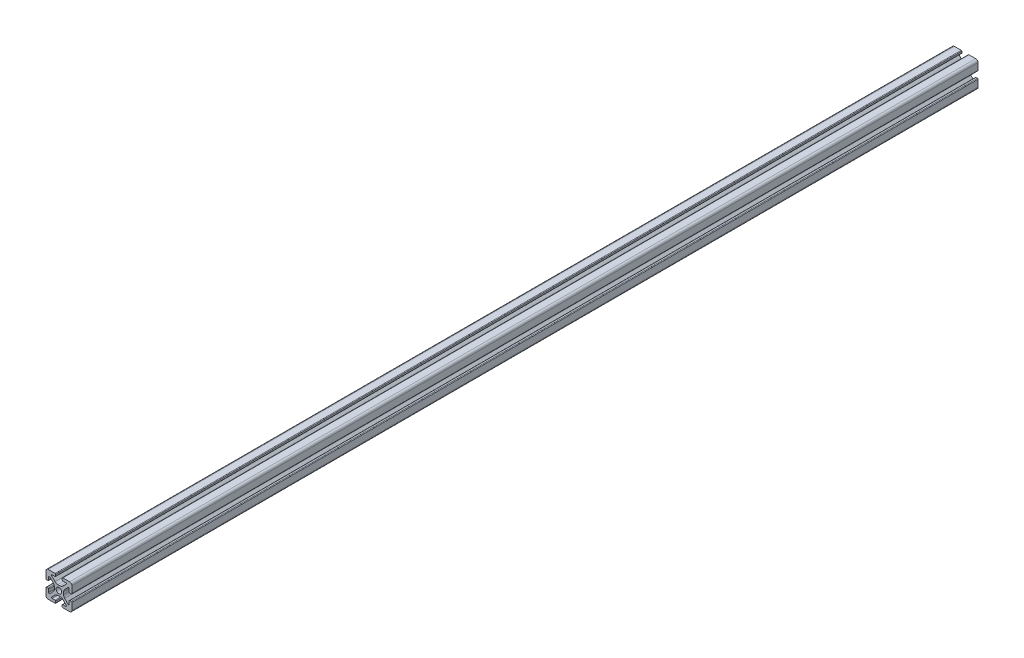
from build123d import *

# Parameters (mm, degrees)
BOSS_EXTRUDE1_DEPTH = 350


with BuildPart() as part:
    # Sketch4 → Boss-Extrude1 (new, symmetric)
    with BuildSketch(Plane.XY):
        with BuildLine():
            Line((3, -10), (8.25, -10))
            ThreePointArc((8.25, -10), (9.487436867, -9.487436867), (10, -8.25))
            Line((10, -8.25), (10, -3))
            ThreePointArc((10, -3), (9.853553391, -2.646446609), (9.5, -2.5))
            Line((9.5, -2.5), (8.424621202, -2.5))
            ThreePointArc((8.424621202, -2.5), (8.071067812, -2.646446609), (7.924621202, -3))
            Line((7.924621202, -3), (7.924621202, -5.25))
            ThreePointArc((7.924621202, -5.25), (7.615962919, -5.711939766), (7.071067812, -5.603553391))
            Line((7.071067812, -5.603553391), (4.478679656, -3.011165235))
            ThreePointArc((4.478679656, -3.011165235), (3.828361402, -2.037895189), (3.6, -0.889844892))
            Line((3.6, -0.889844892), (3.6, 0))
            Line((3.6, 0), (2.15, 0))
            ThreePointArc((2.15, 0), (1.52027958, -1.52027958), (0, -2.15))
            Line((0, -2.15), (0, -3.6))
            Line((0, -3.6), (0.889844892, -3.6))
            ThreePointArc((0.889844892, -3.6), (2.037895189, -3.828361402), (3.011165235, -4.478679656))
            Line((3.011165235, -4.478679656), (5.603553391, -7.071067812))
            ThreePointArc((5.603553391, -7.071067812), (5.711939766, -7.615962919), (5.25, -7.924621202))
            Line((5.25, -7.924621202), (3, -7.924621202))
            ThreePointArc((3, -7.924621202), (2.646446609, -8.071067812), (2.5, -8.424621202))
            Line((2.5, -8.424621202), (2.5, -9.5))
            ThreePointArc((2.5, -9.5), (2.646446609, -9.853553391), (3, -10))
        make_face()
    extrude(amount=BOSS_EXTRUDE1_DEPTH, both=True)

    # Mirror1: part across plane


with BuildPart() as part_1:
    add(part.part)
    add(part.part.mirror(Plane(origin=(0, 0, 0), x_dir=(0, 0, 1), z_dir=(1, 0, 0))))

    # Mirror2: part across plane


with BuildPart() as part_2:
    add(part_1.part)
    add(part_1.part.mirror(Plane.ZX))


solid = part_2.part
